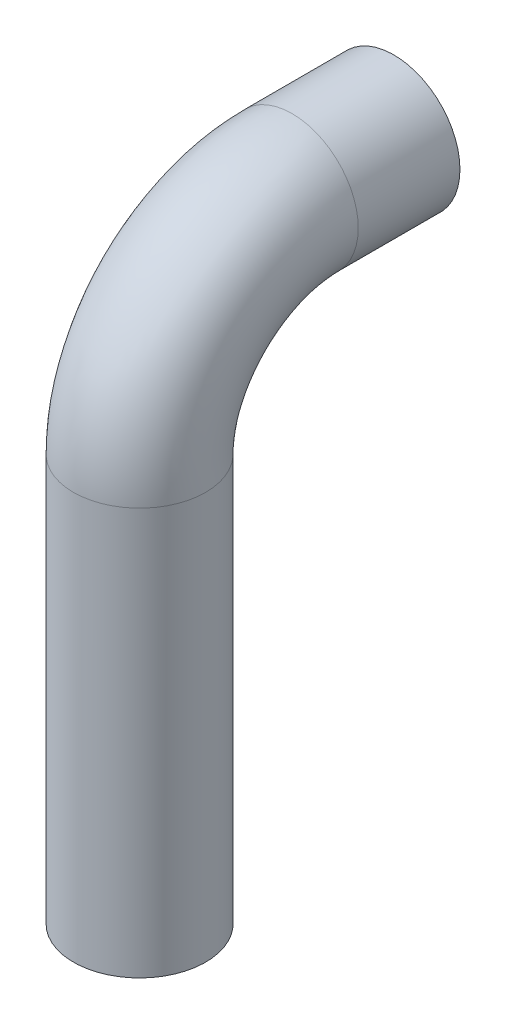
from build123d import *

# Parameters (mm, degrees)
SKETCH2_R   = 13
SKETCH2_R_2 = 10


with BuildPart() as part:
    # Sweep-Thin1: sweep along a path in Sketch1
    with BuildLine(Plane(origin=(0, 0, 0), x_dir=(0, 0, -1), z_dir=(1, 0, 0))) as sweep_thin1_path:
        Line((0, 33.456749572), (-20, 33.456749572))
        ThreePointArc((-20, 33.456749572), (-41.213203436, 24.669953007), (-50, 3.456749572))
        Line((-50, 3.456749572), (-50, -76.543250428))
    # Sketch2 → Sweep-Thin1 (sweep)
    with BuildSketch(Plane.XY):
        with Locations((0, 33.456749572)):
            Circle(SKETCH2_R)
        with Locations((0, 33.456749572)):
            Circle(SKETCH2_R_2, mode=Mode.SUBTRACT)
    sweep(path=sweep_thin1_path.line)


solid = part.part
